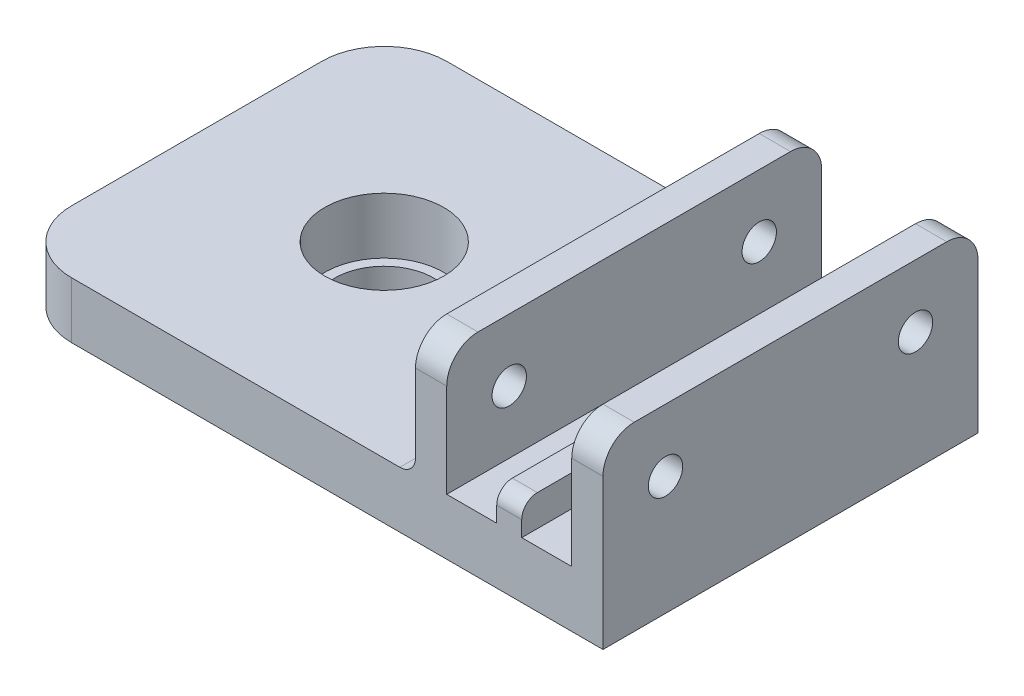
from build123d import *

# Parameters (mm, degrees)
SKETCH1_W            = 95
SKETCH1_H            = 60
BOSS_EXTRUDE1_DEPTH  = 9
SKETCH5_R            = 17.5
BOSS_EXTRUDE2_DEPTH  = 10
SKETCH6_R            = 7.9375
CUT_EXTRUDE1_DEPTH   = 14
SKETCH8_R            = 9.525
CUT_EXTRUDE2_DEPTH   = 9
CUT_EXTRUDE3_REACH   = 76.068
SKETCH9_R            = 3.5
BOSS_EXTRUDE3_START  = -30
SKETCH10_W           = 5
SKETCH10_H           = 20
SKETCH10_W_2         = 4
SKETCH10_H_2         = 5
BOSS_EXTRUDE3_DEPTH  = 60
M5_CLEARANCE_HOLE1_D = 5.5
FILLET1_R            = 5
FILLET2_R            = 2.5
FILLET3_R            = 10
FILLET4_R            = 2.5


with BuildPart() as part:
    # Sketch1 → Boss-Extrude1 (new body)
    with BuildSketch(Plane(origin=(0, 0, 0), x_dir=(1, 0, 0), z_dir=(0, 1, 0))):
        with Locations((17.5, 0)):
            Rectangle(SKETCH1_W, SKETCH1_H)
    extrude(amount=BOSS_EXTRUDE1_DEPTH)

    # Sketch5 → Boss-Extrude2 (add)
    with BuildSketch(Plane.XZ):
        with Locations(Location((0, 0, 0), (0, 0, 270))):
            Circle(SKETCH5_R)
    extrude(amount=BOSS_EXTRUDE2_DEPTH)

    # Sketch6 → Cut-Extrude1 (cut)
    with BuildSketch(Plane(origin=(0, 9, 0), x_dir=(1, 0, 0), z_dir=(0, 1, 0))):
        with Locations(Location((0, 0, 0), (0, 0, 270))):
            Circle(SKETCH6_R)
    extrude(amount=-CUT_EXTRUDE1_DEPTH, mode=Mode.SUBTRACT)

    # Sketch8 → Cut-Extrude2 (cut)
    with BuildSketch(Plane(origin=(0, 9, 0), x_dir=(1, 0, 0), z_dir=(0, 1, 0))):
        with Locations(Location((0, 0, 0), (0, 0, 270))):
            Circle(SKETCH8_R)
    extrude(amount=-CUT_EXTRUDE2_DEPTH, mode=Mode.SUBTRACT)

    # Sketch9 → Cut-Extrude3 (cut, up to next)
    with BuildSketch(Plane.XZ.offset(10), mode=Mode.PRIVATE) as cut_extrude3_sk1:
        with Locations(Location((0, 0, 0), (0, 0, 270))):
            Circle(SKETCH9_R)
    cut_extrude3_tool1 = extrude(cut_extrude3_sk1.sketch, amount=-CUT_EXTRUDE3_REACH, mode=Mode.PRIVATE) & part.part
    add(cut_extrude3_tool1.solids().sort_by_distance((0, -10, 0))[0], mode=Mode.SUBTRACT)

    # Sketch10 → Boss-Extrude3 (add)
    with BuildSketch(Plane.XY.offset(BOSS_EXTRUDE3_START)):
        with Locations((62.5, 19)):
            Rectangle(SKETCH10_W, SKETCH10_H)
        with Locations((37.5, 19)):
            Rectangle(SKETCH10_W, SKETCH10_H)
        with Locations((50, 11.5)):
            Rectangle(SKETCH10_W_2, SKETCH10_H_2)
    extrude(amount=BOSS_EXTRUDE3_DEPTH)

    # M5 Clearance Hole1 (through all)
    with Locations(Plane(origin=(65, 0, 0), x_dir=(0, 0, -1), z_dir=(1, 0, 0))):
        with Locations((-20, 19)):
            m5_clearance_hole1 = Hole(M5_CLEARANCE_HOLE1_D / 2)

    # Mirror1: M5 Clearance Hole1 across plane
    add(m5_clearance_hole1.mirror(Plane.XY), mode=Mode.SUBTRACT)

    # Fillet1
    fillet1_edges = [part.edges().sort_by_distance(p)[0] for p in [
        (62.5, 29, -30),
        (62.5, 29, 30),
        (37.5, 29, -30),
        (37.5, 29, 30),
    ]]
    fillet(fillet1_edges, radius=FILLET1_R)

    # Fillet2
    fillet2_edges = [part.edges().sort_by_distance(p)[0] for p in [
        (50, 14, -30),
        (50, 14, 30),
    ]]
    fillet(fillet2_edges, radius=FILLET2_R)

    # Fillet3
    fillet3_edges = [part.edges().sort_by_distance(p)[0] for p in [
        (-30, 4.5, 30),
        (-30, 4.5, -30),
    ]]
    fillet(fillet3_edges, radius=FILLET3_R)

    # Fillet4
    fillet4_edges = [part.edges().sort_by_distance(p)[0] for p in [
        (35, 9, 0),
    ]]
    fillet(fillet4_edges, radius=FILLET4_R)


solid = part.part
